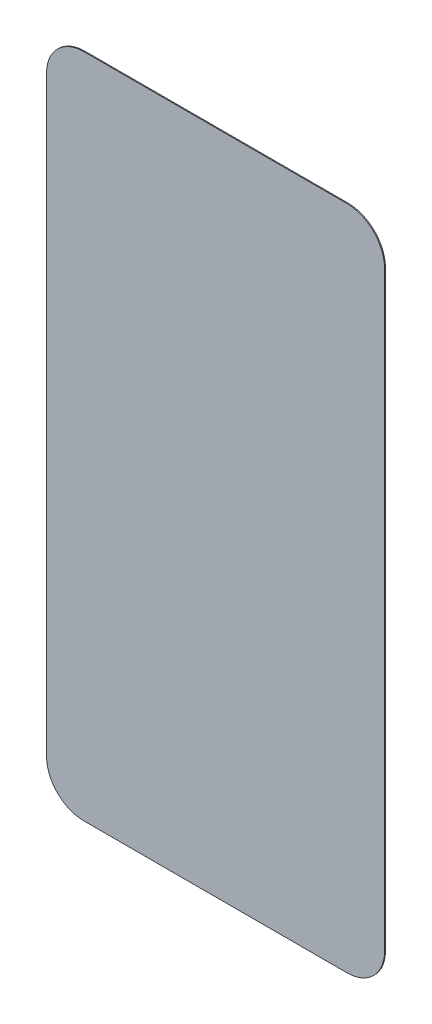
from build123d import *

# Parameters (mm, degrees)
EXTRUDE_1_DEPTH = 0.5


with BuildPart() as part:
    # Эскиз1 → Вытянуть1 (new body)
    with BuildSketch(Plane.XY):
        with BuildLine():
            Line((15.068680731, 21.189389506), (156.068680731, 21.189389506))
            ThreePointArc((156.068680731, 21.189389506), (170.210816355, 15.33152513), (176.068680731, 1.189389506))
            Line((176.068680731, 1.189389506), (176.068680731, -315.571712949))
            ThreePointArc((176.068680731, -315.571712949), (170.210816355, -329.713848573), (156.068680731, -335.571712949))
            Line((156.068680731, -335.571712949), (15.068680731, -335.571712949))
            ThreePointArc((15.068680731, -335.571712949), (0.926545107, -329.713848573), (-4.931319269, -315.571712949))
            Line((-4.931319269, -315.571712949), (-4.931319269, 1.189389506))
            ThreePointArc((-4.931319269, 1.189389506), (0.926545107, 15.33152513), (15.068680731, 21.189389506))
        make_face()
    extrude(amount=EXTRUDE_1_DEPTH)


solid = part.part
